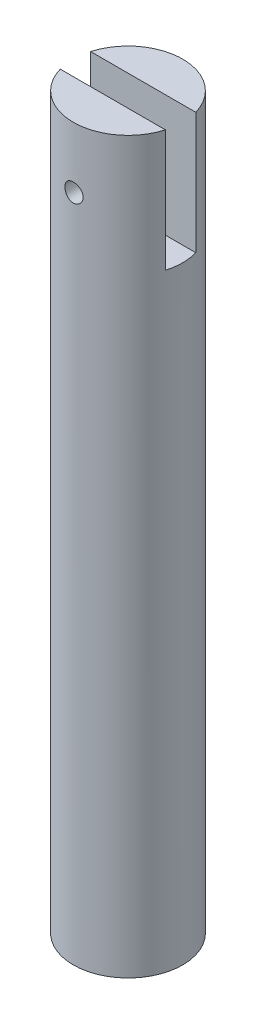
from build123d import *

# Parameters (mm, degrees)
SKETCH1_R               = 18
BOSS_EXTRUDE1_DEPTH     = 120
SKETCH2_W               = 50
SKETCH2_H               = 10
CUT_EXTRUDE1_DEPTH      = 40
CUT_EXTRUDE2_DEPTH      = 123.670289802
CUT_EXTRUDE2_DEPTH_BACK = 123.670289802
SKETCH3_R               = 3


with BuildPart() as part:
    # Sketch1 → Boss-Extrude1 (new, symmetric)
    with BuildSketch(Plane(origin=(0, 0, 0), x_dir=(1, 0, 0), z_dir=(0, 1, 0))):
        with Locations(Location((0, 0, 0), (0, 0, 270))):
            Circle(SKETCH1_R)
    extrude(amount=BOSS_EXTRUDE1_DEPTH, both=True)

    # Sketch2 → Cut-Extrude1 (cut)
    with BuildSketch(Plane(origin=(0, 120, 0), x_dir=(1, 0, 0), z_dir=(0, 1, 0))):
        Rectangle(SKETCH2_W, SKETCH2_H)
    extrude(amount=-CUT_EXTRUDE1_DEPTH, mode=Mode.SUBTRACT)

    # Sketch3 → Cut-Extrude2 (cut, two sides: drawn at the far end of the back side and taken through both)
    with BuildSketch(Plane.XY.offset(-CUT_EXTRUDE2_DEPTH_BACK)):
        with Locations(Location((0, 100, 0), (0, 0, 90))):
            Circle(SKETCH3_R)
    extrude(amount=CUT_EXTRUDE2_DEPTH + CUT_EXTRUDE2_DEPTH_BACK, mode=Mode.SUBTRACT)


solid = part.part
